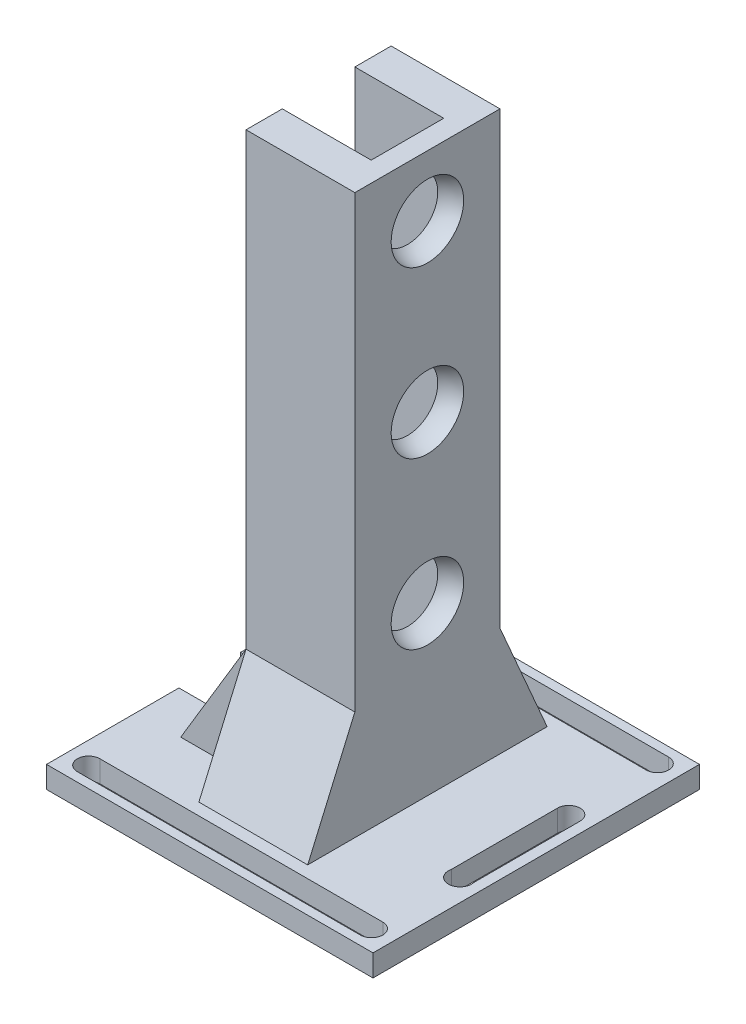
from build123d import *

# Parameters (mm, degrees)
SKETCH_1_W                  = 90
SKETCH_1_H                  = 90
EXTRUDE_1_DEPTH             = 6
SKETCH_2_W                  = 30
SKETCH_2_H                  = 40
EXTRUDE_2_DEPTH             = 160
EXTRUDE_3_REACH             = 174.192
EXTRUDE_3_DIRECTION_2_REACH = 174.192
SKETCH_8_R                  = 3.1
CUT_EXTRUDE_2_DEPTH         = 6
PATTERN_LINEAR_1_COUNT      = 3
PATTERN_LINEAR_1_PITCH      = 45.6
EXTRUDE_4_DEPTH             = 15
CUT_EXTRUDE_4_DEPTH         = 9.5
CUT_EXTRUDE_4_DEPTH_BACK    = 173.191753577
SKETCH_17_W                 = 20
SKETCH_17_H                 = 154
CUT_EXTRUDE_8_DEPTH         = 9.5
CUT_EXTRUDE_8_DEPTH_BACK    = 173.191753577
SKETCH_21_W                 = 17
SKETCH_21_H                 = 6
SKETCH_23_W                 = 78
SKETCH_23_H                 = 6.2
CUT_EXTRUDE_9_DEPTH         = 173.191753577
MIRROR_14_COPY_1_SKETCH_R   = 3.1
MIRROR_14_COPY_1_DEPTH      = 6
SKETCH_25_W                 = 6.229282002
SKETCH_25_H                 = 30
CUT_EXTRUDE_10_DEPTH        = 173.191753577
SKETCH_26_R                 = 3.114641001
CUT_EXTRUDE_11_DEPTH        = 173.191753577
SKETCH_27_R                 = 3.202321727
CUT_EXTRUDE_12_DEPTH        = 173.191753577


with BuildPart() as part:
    # 草图1 → 凸台-拉伸1 (new body)
    with BuildSketch(Plane(origin=(0, 0, 0), x_dir=(1, 0, 0), z_dir=(0, 1, 0))):
        Rectangle(SKETCH_1_W, SKETCH_1_H)
    extrude(amount=EXTRUDE_1_DEPTH)

    # 草图2 → 凸台-拉伸2 (add)
    with BuildSketch(Plane(origin=(0, 0, 0), x_dir=(1, 0, 0), z_dir=(0, 1, 0))):
        Rectangle(SKETCH_2_W, SKETCH_2_H)
    extrude(amount=EXTRUDE_2_DEPTH)

    # 凸台-拉伸3: up to this face of the body (flat: up to its plane)
    extrude_3_end = Plane(part.part.faces().sort_by_distance((0, 83, 20))[0])
    # 草图7 → 凸台-拉伸3 (add, up to the picked face)
    with BuildSketch(Plane.XY, mode=Mode.PRIVATE) as extrude_3_sk1:
        Polygon((-15, 36), (-33, 6), (-15, 6), align=None)
    extrude_3_tool1 = split(extrude(extrude_3_sk1.sketch, amount=EXTRUDE_3_REACH, mode=Mode.PRIVATE), bisect_by=extrude_3_end, keep=Keep.BOTH, mode=Mode.PRIVATE)
    add(extrude_3_tool1.solids().sort_by(Axis((-21, 16, 0), (0, 0, 1)))[0])

    # 凸台-拉伸3 direction 2: up to this face of the body (flat: up to its plane)
    extrude_3_direction_2_end = Plane(part.part.faces().sort_by_distance((0, 83, -20))[0])
    # 草图7 → 凸台-拉伸3 direction 2 (add, up to the picked face)
    with BuildSketch(Plane.XY, mode=Mode.PRIVATE) as extrude_3_direction_2_sk1:
        Polygon((-15, 36), (-33, 6), (-15, 6), align=None)
    extrude_3_direction_2_tool1 = split(extrude(extrude_3_direction_2_sk1.sketch, amount=-EXTRUDE_3_DIRECTION_2_REACH, mode=Mode.PRIVATE), bisect_by=extrude_3_direction_2_end, keep=Keep.BOTH, mode=Mode.PRIVATE)
    add(extrude_3_direction_2_tool1.solids().sort_by(Axis((-21, 16, 0), (0, 0, -1)))[0])

    # 草图8 → 切除-拉伸2 (cut)
    with BuildSketch(Plane(origin=(0, 0, 0), x_dir=(1, 0, 0), z_dir=(0, 1, 0))):
        with Locations(Location((-39, 39.4, 0), (0, 0, 270))):
            Circle(SKETCH_8_R)
    cut_extrude_2 = extrude(amount=CUT_EXTRUDE_2_DEPTH, mode=Mode.SUBTRACT)

    # 草图12 → 切除-旋转2 (revolve, cut)
    with BuildSketch(Plane.XY):
        with BuildLine():
            Line((15, 62), (15, 42))
            ThreePointArc((15, 42), (5, 52), (15, 62))
        make_face()
    cut_revolve_2 = revolve(axis=Axis((15, 62, 0), (0, -1, 0)), mode=Mode.SUBTRACT)

    # 阵列(线性)1: 切除-旋转2 ×3
    with Locations(*[(0, i * PATTERN_LINEAR_1_PITCH, 0) for i in range(1, PATTERN_LINEAR_1_COUNT)]):
        add(cut_revolve_2, mode=Mode.SUBTRACT)

    # 草图15 → 凸台-拉伸4 (add, symmetric)
    with BuildSketch(Plane(origin=(0, 0, 0), x_dir=(0, 0, -1), z_dir=(1, 0, 0))):
        Polygon((-20, 36), (-20, 6), (-33, 6), align=None)
    extrude_4 = extrude(amount=EXTRUDE_4_DEPTH, both=True)

    # 镜向11: 凸台-拉伸4 across plane
    add(extrude_4.mirror(Plane.XY))

    # 草图17 → 切除-拉伸4 (cut, two sides: drawn at the far end of the back side and taken through both)
    with BuildSketch(Plane(origin=(0, 0, 0), x_dir=(0, 0, -1), z_dir=(1, 0, 0)).offset(-CUT_EXTRUDE_4_DEPTH_BACK)):
        with Locations((0, 83)):
            Rectangle(SKETCH_17_W, SKETCH_17_H)
    extrude(amount=CUT_EXTRUDE_4_DEPTH + CUT_EXTRUDE_4_DEPTH_BACK, mode=Mode.SUBTRACT)

    # 草图21 → 切除-拉伸8 (cut, two sides: drawn at the far end of the back side and taken through both)
    with BuildSketch(Plane(origin=(0, 0, 0), x_dir=(0, 0, -1), z_dir=(1, 0, 0)).offset(-CUT_EXTRUDE_8_DEPTH_BACK)):
        with Locations((0, 3)):
            Rectangle(SKETCH_21_W, SKETCH_21_H)
    extrude(amount=CUT_EXTRUDE_8_DEPTH + CUT_EXTRUDE_8_DEPTH_BACK, mode=Mode.SUBTRACT)

    # 镜向12: 切除-拉伸2 across plane
    add(cut_extrude_2.mirror(Plane(origin=(0, 0, 0), x_dir=(0, 0, 1), z_dir=(1, 0, 0))), mode=Mode.SUBTRACT)

    # 草图23 → 切除-拉伸9 (cut, through all)
    with BuildSketch(Plane(origin=(0, 0, 0), x_dir=(1, 0, 0), z_dir=(0, 1, 0))):
        with Locations((0, 39.4)):
            Rectangle(SKETCH_23_W, SKETCH_23_H)
    cut_extrude_9 = extrude(amount=CUT_EXTRUDE_9_DEPTH, mode=Mode.SUBTRACT)

    # 镜向13: 切除-拉伸9 across plane
    add(cut_extrude_9.mirror(Plane.XY), mode=Mode.SUBTRACT)

    # 镜向14: 切除-拉伸2 across plane
    add(cut_extrude_2.mirror(Plane.XY), mode=Mode.SUBTRACT)

    # 镜向14 copy 1 sketch → 镜向14 copy 1 (cut)
    with BuildSketch(Plane(origin=(0, 0, 0), x_dir=(-1, 0, 0), z_dir=(0, 1, 0))):
        with Locations(Location((-39, 39.4, 0), (0, 0, 270))):
            Circle(MIRROR_14_COPY_1_SKETCH_R)
    extrude(amount=MIRROR_14_COPY_1_DEPTH, mode=Mode.SUBTRACT)

    # 草图25 → 切除-拉伸10 (cut, through all)
    with BuildSketch(Plane(origin=(0, 0, 0), x_dir=(1, 0, 0), z_dir=(0, 1, 0))):
        with Locations((38.985358999, 0)):
            Rectangle(SKETCH_25_W, SKETCH_25_H)
    extrude(amount=CUT_EXTRUDE_10_DEPTH, mode=Mode.SUBTRACT)

    # 草图26 → 切除-拉伸11 (cut, through all)
    with BuildSketch(Plane(origin=(0, 0, 0), x_dir=(1, 0, 0), z_dir=(0, 1, 0))):
        with Locations((38.985358999, 15)):
            Circle(SKETCH_26_R)
    extrude(amount=CUT_EXTRUDE_11_DEPTH, mode=Mode.SUBTRACT)

    # 草图27 → 切除-拉伸12 (cut, through all)
    with BuildSketch(Plane(origin=(0, 0, 0), x_dir=(1, 0, 0), z_dir=(0, 1, 0))):
        with Locations((38.985358999, -15)):
            Circle(SKETCH_27_R)
    extrude(amount=CUT_EXTRUDE_12_DEPTH, mode=Mode.SUBTRACT)


solid = part.part
